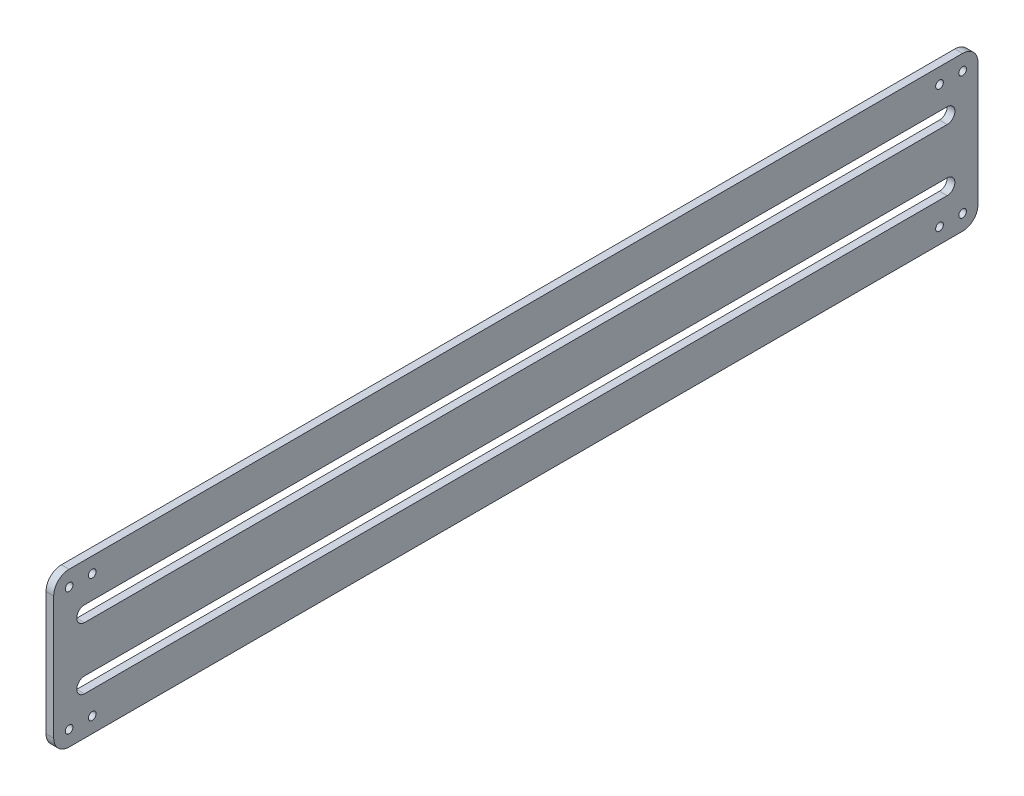
from build123d import *

# Parameters (mm, degrees)
OUTER_CUT_DEPTH   = 1.5875
SLOTS_DEPTH       = 194.153806913
SKETCH3_R         = 1.5875
MOUNT_HOLES_DEPTH = 194.153806913


with BuildPart() as part:
    # Sketch1 → Outer Cut (new, symmetric)
    with BuildSketch(Plane(origin=(0, 0, 0), x_dir=(0, 0, -1), z_dir=(1, 0, 0))):
        with BuildLine():
            Line((-184.15, -31.75), (184.15, -31.75))
            ThreePointArc((184.15, -31.75), (188.640128061, -29.890128061), (190.5, -25.4))
            Line((190.5, -25.4), (190.5, 25.4))
            ThreePointArc((190.5, 25.4), (188.640128061, 29.890128061), (184.15, 31.75))
            Line((184.15, 31.75), (-184.15, 31.75))
            ThreePointArc((-184.15, 31.75), (-188.640128061, 29.890128061), (-190.5, 25.4))
            Line((-190.5, 25.4), (-190.5, -25.4))
            ThreePointArc((-190.5, -25.4), (-188.640128061, -29.890128061), (-184.15, -31.75))
        make_face()
    extrude(amount=OUTER_CUT_DEPTH, both=True)

    # Sketch2 → Slots (cut, through all)
    with BuildSketch(Plane(origin=(1.5875, 0, 0), x_dir=(0, 0, -1), z_dir=(1, 0, 0))):
        with BuildLine():
            Line((-177.8, 15.875), (177.8, 15.875))
            ThreePointArc((177.8, 15.875), (180.975, 12.7), (177.8, 9.525))
            Line((177.8, 9.525), (-177.8, 9.525))
            ThreePointArc((-177.8, 9.525), (-180.975, 12.7), (-177.8, 15.875))
        make_face()
        with BuildLine():
            Line((-177.8, -15.875), (177.8, -15.875))
            ThreePointArc((177.8, -15.875), (180.975, -12.7), (177.8, -9.525))
            Line((177.8, -9.525), (-177.8, -9.525))
            ThreePointArc((-177.8, -9.525), (-180.975, -12.7), (-177.8, -15.875))
        make_face()
    extrude(amount=-SLOTS_DEPTH, mode=Mode.SUBTRACT)

    # Sketch3 → Mount Holes (cut, through all)
    with BuildSketch(Plane(origin=(1.5875, 0, 0), x_dir=(0, 0, -1), z_dir=(1, 0, 0))):
        with Locations((-184.15, 25.4)):
            Circle(SKETCH3_R)
        with Locations((-174.625, 25.4)):
            Circle(SKETCH3_R)
        with Locations(Location((-174.625, -25.4, 0), (0, 0, 180))):
            Circle(SKETCH3_R)
        with Locations(Location((-184.15, -25.4, 0), (0, 0, 180))):
            Circle(SKETCH3_R)
        with Locations(Location((174.625, 25.4, 0), (0, 0, 180))):
            Circle(SKETCH3_R)
        with Locations(Location((184.15, 25.4, 0), (0, 0, 180))):
            Circle(SKETCH3_R)
        with Locations((184.15, -25.4)):
            Circle(SKETCH3_R)
        with Locations((174.625, -25.4)):
            Circle(SKETCH3_R)
    extrude(amount=-MOUNT_HOLES_DEPTH, mode=Mode.SUBTRACT)


solid = part.part
